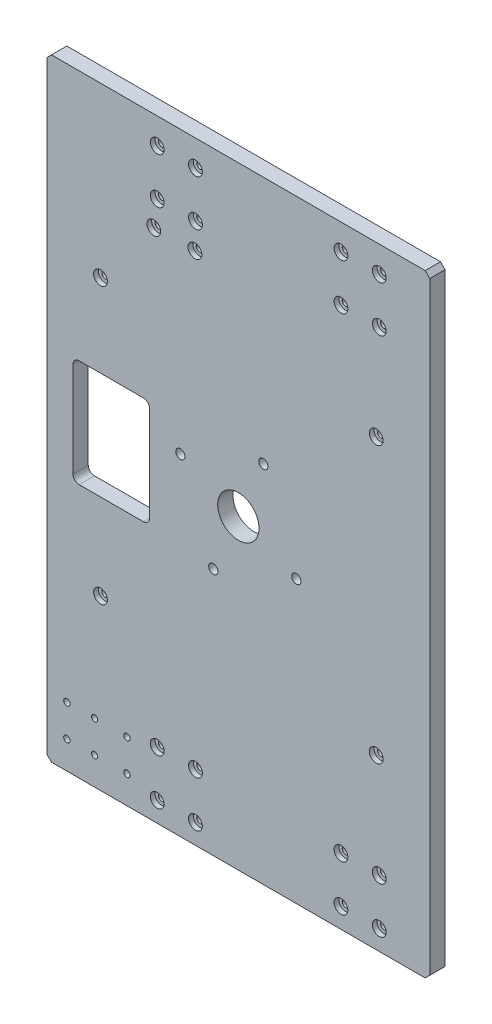
from build123d import *

# Parameters (mm, degrees)
ESQUISSE1_W                                  = 250
ESQUISSE1_H                                  = 400
BOSS_EXTRU_1_DEPTH                           = 10
ESQUISSE2_R                                  = 13.5
ENL_V_MAT_EXTRU_1_DEPTH                      = 237.061432682
CHANFREIN1_SIZE                              = 3
TROU_TARAUD_M51_D                            = 4.2
TROUS_DE_CENTRAGE_4_0MM2_D                   = 4
TROUS_DE_CENTRAGE_6_0MM2_D                   = 6
D_GAGEMENT_M41_D                             = 4.5
R_P_TITION_LIN_AIRE1_COUNT                   = 2
R_P_TITION_LIN_AIRE1_PITCH                   = 120
R_P_TITION_LIN_AIRE1_COUNT_DIR2              = 2
R_P_TITION_LIN_AIRE1_PITCH_DIR2              = 340
R_P_TITION_LIN_AIRE2_COUNT                   = 2
R_P_TITION_LIN_AIRE2_PITCH                   = 30
R_P_TITION_LIN_AIRE2_COUNT_DIR2              = 2
R_P_TITION_LIN_AIRE2_PITCH_DIR2              = 25
R_P_TITION_LIN_AIRE3_COUNT                   = 2
R_P_TITION_LIN_AIRE3_PITCH                   = 120
R_P_TITION_LIN_AIRE3_COUNT_DIR2              = 2
R_P_TITION_LIN_AIRE3_PITCH_DIR2              = 340
D_GAGEMENT_M42_D                             = 4.5
CHAMBRAGE_POUR_VIS_T_TE_RONDE_BOMB_2_A_COUNT = 2
CHAMBRAGE_POUR_VIS_T_TE_RONDE_BOMB_2_A_PITCH = 180
CHAMBRAGE_POUR_VIS_T_TE_RONDE_BOMB_3_COUNT   = 2
CHAMBRAGE_POUR_VIS_T_TE_RONDE_BOMB_3_PITCH   = 180
CHAMBRAGE_POUR_VIS_T_TE_RONDE_BOMB_4_COUNT   = 2
CHAMBRAGE_POUR_VIS_T_TE_RONDE_BOMB_4_PITCH   = 254.558441227
D_GAGEMENT_M43_D                             = 4.5
CHAMBRAGE_POUR_VIS_T_TE_RONDE_BOMB_5_A_COUNT = 2
CHAMBRAGE_POUR_VIS_T_TE_RONDE_BOMB_5_A_PITCH = 26.858717456
CUT_EXTRUDE1_DEPTH                           = 10


with BuildPart() as part:
    # Esquisse1 → Boss.-Extru.1 (new body)
    with BuildSketch(Plane.XY):
        Rectangle(ESQUISSE1_W, ESQUISSE1_H)
    extrude(amount=BOSS_EXTRU_1_DEPTH)

    # Esquisse2 → Enlèv. mat.-Extru.1 (cut, through all)
    with BuildSketch(Plane(origin=(0, 0, 0), x_dir=(-1, 0, 0), z_dir=(0, 0, -1))):
        Circle(ESQUISSE2_R)
    extrude(amount=-ENL_V_MAT_EXTRU_1_DEPTH, mode=Mode.SUBTRACT)

    # Chanfrein1
    chanfrein1_edges = [part.edges().sort_by_distance(p)[0] for p in [
        (125, -200, 5),
        (-125, -200, 5),
        (-125, 200, 5),
        (125, 200, 5),
    ]]
    chamfer(chanfrein1_edges, length=CHANFREIN1_SIZE)

    # Trou taraudé M51 (through all)
    with Locations(Plane.XY.offset(10)):
        with Locations((-72.698486264, -161.07971462), (-72.698486264, -181.838730229), (-111.937151978, -181.838730229), (-111.937151978, -161.07971462)):
            Hole(TROU_TARAUD_M51_D / 2)

    # Trous de centrage Ø4.0mm2 (through all)
    with Locations(Plane.XY.offset(10)):
        with Locations((-93.86308218, -161.07971462), (-93.86308218, -181.838730229)):
            Hole(TROUS_DE_CENTRAGE_4_0MM2_D / 2)

    # Trous de centrage Ø6.0mm2 (through all)
    with Locations(Plane.XY.offset(10)):
        with Locations((16.357059687, 37.86831259), (37.86831259, -16.357059687), (-16.357059687, -37.86831259), (-37.86831259, 16.357059687)):
            Hole(TROUS_DE_CENTRAGE_6_0MM2_D / 2)

    # Dégagement M41 (through all)
    with Locations(Plane(origin=(0, 0, 0), x_dir=(-1, 0, 0), z_dir=(0, 0, -1))):
        with Locations((28, -187), (28, -157), (53, -157), (53, -187)):
            d_gagement_m41 = Hole(D_GAGEMENT_M41_D / 2)

    # Répétition linéaire1: D_gagement M41 2 × 2
    with Locations(*[(i * R_P_TITION_LIN_AIRE1_PITCH, j * R_P_TITION_LIN_AIRE1_PITCH_DIR2, 0) for i in range(R_P_TITION_LIN_AIRE1_COUNT) for j in range(R_P_TITION_LIN_AIRE1_COUNT_DIR2) if (i, j) != (0, 0)]):
        add(d_gagement_m41, mode=Mode.SUBTRACT)

    # Esquisse29 → Chambrage pour vis _ t_te ronde bomb_e M (revolve, cut)
    with BuildSketch(Plane(origin=(92, -157, 10), x_dir=(0, -1, 0), z_dir=(1, 0, 0))):
        Polygon((0, 0), (0, 10), (2.25, 10), (2.25, 3.125), (2.275, 3.1), (4.5, 3.1), (4.5, 0), align=None)
    chambrage_pour_vis_t_te_ronde_bomb_e_m = revolve(axis=Axis((92, -157, 16.35), (0, 0, -1)), mode=Mode.SUBTRACT)

    # Répétition linéaire2: Chambrage pour vis _ t_te ronde bomb_e M 2 × 2
    with Locations(*[(-j * R_P_TITION_LIN_AIRE2_PITCH_DIR2, -i * R_P_TITION_LIN_AIRE2_PITCH, 0) for i in range(R_P_TITION_LIN_AIRE2_COUNT) for j in range(R_P_TITION_LIN_AIRE2_COUNT_DIR2) if (i, j) != (0, 0)]):
        add(chambrage_pour_vis_t_te_ronde_bomb_e_m, mode=Mode.SUBTRACT)

    # Répétition linéaire3: Chambrage pour vis _ t_te ronde bomb_e M 2 × 2
    with Locations(*[(-i * R_P_TITION_LIN_AIRE3_PITCH, j * R_P_TITION_LIN_AIRE3_PITCH_DIR2, 0) for i in range(R_P_TITION_LIN_AIRE3_COUNT) for j in range(R_P_TITION_LIN_AIRE3_COUNT_DIR2) if (i, j) != (0, 0)]):
        add(chambrage_pour_vis_t_te_ronde_bomb_e_m, mode=Mode.SUBTRACT)

    # Répétition linéaire3 copy 1 sketch → Répétition linéaire3 copy 1 (revolve, cut)
    with BuildSketch(Plane(origin=(67, 183, 10), x_dir=(0, -1, 0), z_dir=(1, 0, 0))):
        Polygon((0, 0), (0, 10), (2.25, 10), (2.25, 3.125), (2.275, 3.1), (4.5, 3.1), (4.5, 0), align=None)
    revolve(axis=Axis((67, 183, 16.35), (0, 0, -1)), mode=Mode.SUBTRACT)

    # Répétition linéaire3 copy 2 sketch → Répétition linéaire3 copy 2 (revolve, cut)
    with BuildSketch(Plane(origin=(-53, -157, 10), x_dir=(0, -1, 0), z_dir=(1, 0, 0))):
        Polygon((0, 0), (0, 10), (2.25, 10), (2.25, 3.125), (2.275, 3.1), (4.5, 3.1), (4.5, 0), align=None)
    revolve(axis=Axis((-53, -157, 16.35), (0, 0, -1)), mode=Mode.SUBTRACT)

    # Répétition linéaire3 copy 3 sketch → Répétition linéaire3 copy 3 (revolve, cut)
    with BuildSketch(Plane(origin=(-53, 183, 10), x_dir=(0, -1, 0), z_dir=(1, 0, 0))):
        Polygon((0, 0), (0, 10), (2.25, 10), (2.25, 3.125), (2.275, 3.1), (4.5, 3.1), (4.5, 0), align=None)
    revolve(axis=Axis((-53, 183, 16.35), (0, 0, -1)), mode=Mode.SUBTRACT)

    # Répétition linéaire3 copy 4 sketch → Répétition linéaire3 copy 4 (revolve, cut)
    with BuildSketch(Plane(origin=(92, 153, 10), x_dir=(0, -1, 0), z_dir=(1, 0, 0))):
        Polygon((0, 0), (0, 10), (2.25, 10), (2.25, 3.125), (2.275, 3.1), (4.5, 3.1), (4.5, 0), align=None)
    revolve(axis=Axis((92, 153, 16.35), (0, 0, -1)), mode=Mode.SUBTRACT)

    # Répétition linéaire3 copy 5 sketch → Répétition linéaire3 copy 5 (revolve, cut)
    with BuildSketch(Plane(origin=(-28, -187, 10), x_dir=(0, -1, 0), z_dir=(1, 0, 0))):
        Polygon((0, 0), (0, 10), (2.25, 10), (2.25, 3.125), (2.275, 3.1), (4.5, 3.1), (4.5, 0), align=None)
    revolve(axis=Axis((-28, -187, 16.35), (0, 0, -1)), mode=Mode.SUBTRACT)

    # Répétition linéaire3 copy 6 sketch → Répétition linéaire3 copy 6 (revolve, cut)
    with BuildSketch(Plane(origin=(-28, 153, 10), x_dir=(0, -1, 0), z_dir=(1, 0, 0))):
        Polygon((0, 0), (0, 10), (2.25, 10), (2.25, 3.125), (2.275, 3.1), (4.5, 3.1), (4.5, 0), align=None)
    revolve(axis=Axis((-28, 153, 16.35), (0, 0, -1)), mode=Mode.SUBTRACT)

    # Répétition linéaire3 copy 7 sketch → Répétition linéaire3 copy 7 (revolve, cut)
    with BuildSketch(Plane(origin=(67, 153, 10), x_dir=(0, -1, 0), z_dir=(1, 0, 0))):
        Polygon((0, 0), (0, 10), (2.25, 10), (2.25, 3.125), (2.275, 3.1), (4.5, 3.1), (4.5, 0), align=None)
    revolve(axis=Axis((67, 153, 16.35), (0, 0, -1)), mode=Mode.SUBTRACT)

    # Répétition linéaire3 copy 8 sketch → Répétition linéaire3 copy 8 (revolve, cut)
    with BuildSketch(Plane(origin=(-53, -187, 10), x_dir=(0, -1, 0), z_dir=(1, 0, 0))):
        Polygon((0, 0), (0, 10), (2.25, 10), (2.25, 3.125), (2.275, 3.1), (4.5, 3.1), (4.5, 0), align=None)
    revolve(axis=Axis((-53, -187, 16.35), (0, 0, -1)), mode=Mode.SUBTRACT)

    # Répétition linéaire3 copy 9 sketch → Répétition linéaire3 copy 9 (revolve, cut)
    with BuildSketch(Plane(origin=(-53, 153, 10), x_dir=(0, -1, 0), z_dir=(1, 0, 0))):
        Polygon((0, 0), (0, 10), (2.25, 10), (2.25, 3.125), (2.275, 3.1), (4.5, 3.1), (4.5, 0), align=None)
    revolve(axis=Axis((-53, 153, 16.35), (0, 0, -1)), mode=Mode.SUBTRACT)

    # Dégagement M42 (through all)
    with Locations(Plane(origin=(0, 0, 0), x_dir=(-1, 0, 0), z_dir=(0, 0, -1))):
        with Locations((90, -90), (90, 90), (-90, 90), (-90, -90)):
            Hole(D_GAGEMENT_M42_D / 2)

    # Esquisse33 → Chambrage pour vis _ t_te ronde bomb 2 (revolve, cut)
    with BuildSketch(Plane(origin=(-90, -90, 10), x_dir=(0, -1, 0), z_dir=(1, 0, 0))):
        Polygon((0, 0), (0, 10), (2.25, 10), (2.25, 3.125), (2.275, 3.1), (4.5, 3.1), (4.5, 0), align=None)
    chambrage_pour_vis_t_te_ronde_bomb_2 = revolve(axis=Axis((-90, -90, 16.35), (0, 0, -1)), mode=Mode.SUBTRACT)

    # Chambrage pour vis _ t_te ronde bomb 2 a: Chambrage pour vis _ t_te ronde bomb 2 ×2
    with Locations(*[(0, i * CHAMBRAGE_POUR_VIS_T_TE_RONDE_BOMB_2_A_PITCH, 0) for i in range(1, CHAMBRAGE_POUR_VIS_T_TE_RONDE_BOMB_2_A_COUNT)]):
        add(chambrage_pour_vis_t_te_ronde_bomb_2, mode=Mode.SUBTRACT)

    # Chambrage pour vis _ t_te ronde bomb 3: Chambrage pour vis _ t_te ronde bomb 2 ×2
    with Locations(*[(i * CHAMBRAGE_POUR_VIS_T_TE_RONDE_BOMB_3_PITCH, 0, 0) for i in range(1, CHAMBRAGE_POUR_VIS_T_TE_RONDE_BOMB_3_COUNT)]):
        add(chambrage_pour_vis_t_te_ronde_bomb_2, mode=Mode.SUBTRACT)

    # Chambrage pour vis _ t_te ronde bomb 4: Chambrage pour vis _ t_te ronde bomb 2 ×2
    with Locations(*[Vector(0.7071067811864814, 0.7071067811866137, 0) * (i * CHAMBRAGE_POUR_VIS_T_TE_RONDE_BOMB_4_PITCH) for i in range(1, CHAMBRAGE_POUR_VIS_T_TE_RONDE_BOMB_4_COUNT)]):
        add(chambrage_pour_vis_t_te_ronde_bomb_2, mode=Mode.SUBTRACT)

    # Dégagement M43 (through all)
    with Locations(Plane(origin=(0, 0, 0), x_dir=(-1, 0, 0), z_dir=(0, 0, -1))):
        with Locations((55.199022773, 135.70653433), (28.341819814, 135.991758108)):
            Hole(D_GAGEMENT_M43_D / 2)

    # Esquisse37 → Chambrage pour vis _ t_te ronde bomb 5 (revolve, cut)
    with BuildSketch(Plane(origin=(-55.199022773, 135.70653433, 10), x_dir=(0, -1, 0), z_dir=(1, 0, 0))):
        Polygon((0, 0), (0, 10), (2.25, 10), (2.25, 3.125), (2.275, 3.1), (4.5, 3.1), (4.5, 0), align=None)
    chambrage_pour_vis_t_te_ronde_bomb_5 = revolve(axis=Axis((-55.199022773, 135.70653433, 16.35), (0, 0, -1)), mode=Mode.SUBTRACT)

    # Chambrage pour vis _ t_te ronde bomb 5 a: Chambrage pour vis _ t_te ronde bomb 5 ×2
    with Locations(*[Vector(0.9999436124580966, 0.010619411671655749, 0) * (i * CHAMBRAGE_POUR_VIS_T_TE_RONDE_BOMB_5_A_PITCH) for i in range(1, CHAMBRAGE_POUR_VIS_T_TE_RONDE_BOMB_5_A_COUNT)]):
        add(chambrage_pour_vis_t_te_ronde_bomb_5, mode=Mode.SUBTRACT)

    # Sketch2 → Cut-Extrude1 (cut)
    with BuildSketch(Plane.XY.offset(10)):
        with BuildLine():
            Line((-104, 36), (-62, 36))
            ThreePointArc((-62, 36), (-59.171572875, 34.828427125), (-58, 32))
            Line((-58, 32), (-58, -30))
            ThreePointArc((-58, -30), (-59.171572875, -32.828427125), (-62, -34))
            Line((-62, -34), (-104, -34))
            ThreePointArc((-104, -34), (-106.828427125, -32.828427125), (-108, -30))
            Line((-108, -30), (-108, 32))
            ThreePointArc((-108, 32), (-106.828427125, 34.828427125), (-104, 36))
        make_face()
    extrude(amount=-CUT_EXTRUDE1_DEPTH, mode=Mode.SUBTRACT)


solid = part.part
